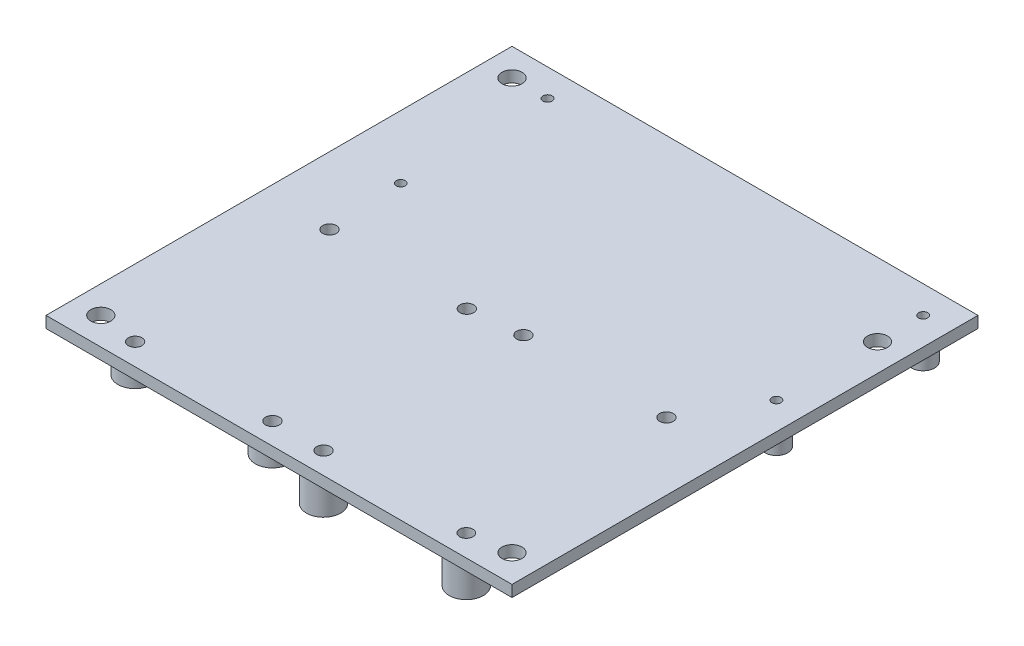
from build123d import *

# Parameters (mm, degrees)
SKETCH_1_W          = 82
SKETCH_1_H          = 82
SKETCH_1_R          = 1.75
EXTRUDE_1_DEPTH     = 2
CUT_EXTRUDE_START   = -2
SKETCH_2_R          = 1.75
SKETCH_2_R_2        = 0.8
SKETCH_2_R_3        = 1.2
CUT_EXTRUDE_1_DEPTH = 2
EXTRUDE_START       = -7
SKETCH_4_R          = 2
SKETCH_4_R_2        = 0.8
EXTRUDE_2_DEPTH     = 7
EXTRUDE_START_2     = -5
SKETCH_5_R          = 3
SKETCH_5_R_2        = 1.2
EXTRUDE_3_DEPTH     = 5
EXTRUDE_START_3     = -8
SKETCH_6_R          = 3
SKETCH_6_R_2        = 1.2
SKETCH_6_R_3        = 1.158828733
EXTRUDE_4_DEPTH     = 8
CUT_EXTRUDE_2_REACH = 82.589
SKETCH_7_W          = 82
SKETCH_7_H          = 82
SKETCH_7_W_2        = 81.6
SKETCH_7_H_2        = 81.6


with BuildPart() as part:
    # 草圖1 → 填料-伸長1 (new body)
    with BuildSketch(Plane(origin=(0, 0, 0), x_dir=(1, 0, 0), z_dir=(0, 1, 0))):
        with Locations((-4.734930226, -24.870201097)):
            Rectangle(SKETCH_1_W, SKETCH_1_H)
        with Locations(Location((-40.734930226, 11.129798903, 0), (0, 0, 270))):
            Circle(SKETCH_1_R, mode=Mode.SUBTRACT)
        with Locations(Location((-40.734930226, -60.870201097, 0), (0, 0, 270))):
            Circle(SKETCH_1_R, mode=Mode.SUBTRACT)
        with Locations(Location((31.265069774, 3.129798903, 0), (0, 0, 270))):
            Circle(SKETCH_1_R, mode=Mode.SUBTRACT)
        with Locations(Location((31.265069774, -60.870201097, 0), (0, 0, 270))):
            Circle(SKETCH_1_R, mode=Mode.SUBTRACT)
    extrude(amount=EXTRUDE_1_DEPTH)

    # 草圖2 → 除料-伸長1 (cut)
    with BuildSketch(Plane(origin=(0, 2, 0), x_dir=(1, 0, 0), z_dir=(0, 1, 0)).offset(CUT_EXTRUDE_START)):
        with Locations(Location((-40.734930226, 11.129798903, 0), (0, 0, 270))):
            Circle(SKETCH_2_R)
        with Locations(Location((-34.514930226, -14.570201097, 0), (0, 0, 270))):
            Circle(SKETCH_2_R_2)
        with Locations(Location((31.265069774, -14.570201097, 0), (0, 0, 270))):
            Circle(SKETCH_2_R_2)
        with Locations(Location((-33.734930226, -27.820201097, 0), (0, 0, 270))):
            Circle(SKETCH_2_R_3)
        with Locations(Location((-33.734930226, -61.870201097, 0), (0, 0, 270))):
            Circle(SKETCH_2_R_3)
        with Locations(Location((-9.684930226, -27.820201097, 0), (0, 0, 270))):
            Circle(SKETCH_2_R_3)
        with Locations(Location((-9.684930226, -61.870201097, 0), (0, 0, 270))):
            Circle(SKETCH_2_R_3)
        with Locations(Location((-0.734896325, -26.870201097, 0), (0, 0, 270))):
            Circle(SKETCH_2_R_3)
        with Locations(Location((24.265069774, -26.82902983, 0), (0, 0, 270))):
            Circle(SKETCH_2_R_3)
        with Locations(Location((-0.734896325, -61.870201097, 0), (0, 0, 270))):
            Circle(SKETCH_2_R_3)
        with Locations(Location((24.265069774, -61.82902983, 0), (0, 0, 270))):
            Circle(SKETCH_2_R_3)
        with Locations(Location((31.265069774, 11.129798903, 0), (0, 0, 270))):
            Circle(SKETCH_2_R_2)
        with Locations(Location((-34.514930226, 11.129798903, 0), (0, 0, 270))):
            Circle(SKETCH_2_R_2)
    extrude(amount=CUT_EXTRUDE_1_DEPTH, mode=Mode.SUBTRACT)

    # 草圖4 → 填料-伸長2 (add)
    # profile 1 of 4: a face of its own
    with BuildSketch(Plane(origin=(0, 2, 0), x_dir=(1, 0, 0), z_dir=(0, 1, 0)).offset(EXTRUDE_START)):
        with Locations(Location((-34.514930226, 11.129798903, 0), (0, 0, 270))):
            Circle(SKETCH_4_R)
        with Locations(Location((-34.514930226, 11.129798903, 0), (0, 0, 270))):
            Circle(SKETCH_4_R_2, mode=Mode.SUBTRACT)
    # profile 2 of 4: a face of its own
    with BuildSketch(Plane(origin=(0, 2, 0), x_dir=(1, 0, 0), z_dir=(0, 1, 0)).offset(EXTRUDE_START)):
        with Locations(Location((-34.514930226, -14.570201097, 0), (0, 0, 270))):
            Circle(SKETCH_4_R)
        with Locations(Location((-34.514930226, -14.570201097, 0), (0, 0, 270))):
            Circle(SKETCH_4_R_2, mode=Mode.SUBTRACT)
    # profile 3 of 4: a face of its own
    with BuildSketch(Plane(origin=(0, 2, 0), x_dir=(1, 0, 0), z_dir=(0, 1, 0)).offset(EXTRUDE_START)):
        with Locations(Location((31.265069774, 11.129798903, 0), (0, 0, 270))):
            Circle(SKETCH_4_R)
        with Locations(Location((31.265069774, 11.129798903, 0), (0, 0, 270))):
            Circle(SKETCH_4_R_2, mode=Mode.SUBTRACT)
    # profile 4 of 4: a face of its own
    with BuildSketch(Plane(origin=(0, 2, 0), x_dir=(1, 0, 0), z_dir=(0, 1, 0)).offset(EXTRUDE_START)):
        with Locations(Location((31.265069774, -14.570201097, 0), (0, 0, 270))):
            Circle(SKETCH_4_R)
        with Locations(Location((31.265069774, -14.570201097, 0), (0, 0, 270))):
            Circle(SKETCH_4_R_2, mode=Mode.SUBTRACT)
    extrude(amount=EXTRUDE_2_DEPTH)

    # 草圖5 → 填料-伸長3 (add)
    # profile 1 of 4: a face of its own
    with BuildSketch(Plane(origin=(0, 2, 0), x_dir=(1, 0, 0), z_dir=(0, 1, 0)).offset(EXTRUDE_START_2)):
        with Locations(Location((-33.734930226, -27.820201097, 0), (0, 0, 270))):
            Circle(SKETCH_5_R)
        with Locations(Location((-33.734930226, -27.820201097, 0), (0, 0, 270))):
            Circle(SKETCH_5_R_2, mode=Mode.SUBTRACT)
    # profile 2 of 4: a face of its own
    with BuildSketch(Plane(origin=(0, 2, 0), x_dir=(1, 0, 0), z_dir=(0, 1, 0)).offset(EXTRUDE_START_2)):
        with Locations(Location((-9.684930226, -27.820201097, 0), (0, 0, 270))):
            Circle(SKETCH_5_R)
        with Locations(Location((-9.684930226, -27.820201097, 0), (0, 0, 270))):
            Circle(SKETCH_5_R_2, mode=Mode.SUBTRACT)
    # profile 3 of 4: a face of its own
    with BuildSketch(Plane(origin=(0, 2, 0), x_dir=(1, 0, 0), z_dir=(0, 1, 0)).offset(EXTRUDE_START_2)):
        with Locations(Location((-33.734930226, -61.870201097, 0), (0, 0, 270))):
            Circle(SKETCH_5_R)
        with Locations(Location((-33.734930226, -61.870201097, 0), (0, 0, 270))):
            Circle(SKETCH_5_R_2, mode=Mode.SUBTRACT)
    # profile 4 of 4: a face of its own
    with BuildSketch(Plane(origin=(0, 2, 0), x_dir=(1, 0, 0), z_dir=(0, 1, 0)).offset(EXTRUDE_START_2)):
        with Locations(Location((-9.684930226, -61.870201097, 0), (0, 0, 270))):
            Circle(SKETCH_5_R)
        with Locations(Location((-9.684930226, -61.870201097, 0), (0, 0, 270))):
            Circle(SKETCH_5_R_2, mode=Mode.SUBTRACT)
    extrude(amount=EXTRUDE_3_DEPTH)

    # 草圖6 → 填料-伸長4 (add)
    # profile 1 of 4: a face of its own
    with BuildSketch(Plane(origin=(0, 2, 0), x_dir=(1, 0, 0), z_dir=(0, 1, 0)).offset(EXTRUDE_START_3)):
        with Locations(Location((-0.734896325, -26.870201097, 0), (0, 0, 270))):
            Circle(SKETCH_6_R)
        with Locations(Location((-0.734896325, -26.870201097, 0), (0, 0, 270))):
            Circle(SKETCH_6_R_2, mode=Mode.SUBTRACT)
    # profile 2 of 4: a face of its own
    with BuildSketch(Plane(origin=(0, 2, 0), x_dir=(1, 0, 0), z_dir=(0, 1, 0)).offset(EXTRUDE_START_3)):
        with Locations(Location((24.265069774, -26.82902983, 0), (0, 0, 270))):
            Circle(SKETCH_6_R)
        with Locations(Location((24.265069774, -26.82902983, 0), (0, 0, 270))):
            Circle(SKETCH_6_R_2, mode=Mode.SUBTRACT)
    # profile 3 of 4: a face of its own
    with BuildSketch(Plane(origin=(0, 2, 0), x_dir=(1, 0, 0), z_dir=(0, 1, 0)).offset(EXTRUDE_START_3)):
        with Locations(Location((-0.734896325, -61.870201097, 0), (0, 0, 270))):
            Circle(SKETCH_6_R)
        with Locations(Location((-0.734896325, -61.870201097, 0), (0, 0, 270))):
            Circle(SKETCH_6_R_2, mode=Mode.SUBTRACT)
    # profile 4 of 4: a face of its own
    with BuildSketch(Plane(origin=(0, 2, 0), x_dir=(1, 0, 0), z_dir=(0, 1, 0)).offset(EXTRUDE_START_3)):
        with Locations(Location((24.265069774, -61.870201097, 0), (0, 0, 270))):
            Circle(SKETCH_6_R)
        with Locations(Location((24.265069774, -61.870201097, 0), (0, 0, 270))):
            Circle(SKETCH_6_R_3, mode=Mode.SUBTRACT)
    extrude(amount=EXTRUDE_4_DEPTH)

    # 草圖7 → 除料-伸長2 (cut, up to next)
    with BuildSketch(Plane(origin=(0, 2, 0), x_dir=(1, 0, 0), z_dir=(0, 1, 0)), mode=Mode.PRIVATE) as cut_extrude_2_sk1:
        with Locations((-4.734930226, -24.870201097)):
            Rectangle(SKETCH_7_W, SKETCH_7_H)
        with Locations((-4.734930226, -24.870201097)):
            Rectangle(SKETCH_7_W_2, SKETCH_7_H_2, mode=Mode.SUBTRACT)
    cut_extrude_2_tool1 = extrude(cut_extrude_2_sk1.sketch, amount=-CUT_EXTRUDE_2_REACH, mode=Mode.PRIVATE) & part.part
    add(cut_extrude_2_tool1.solids().sort_by_distance((-4.73493, 2, -16.013833))[0], mode=Mode.SUBTRACT)


solid = part.part
